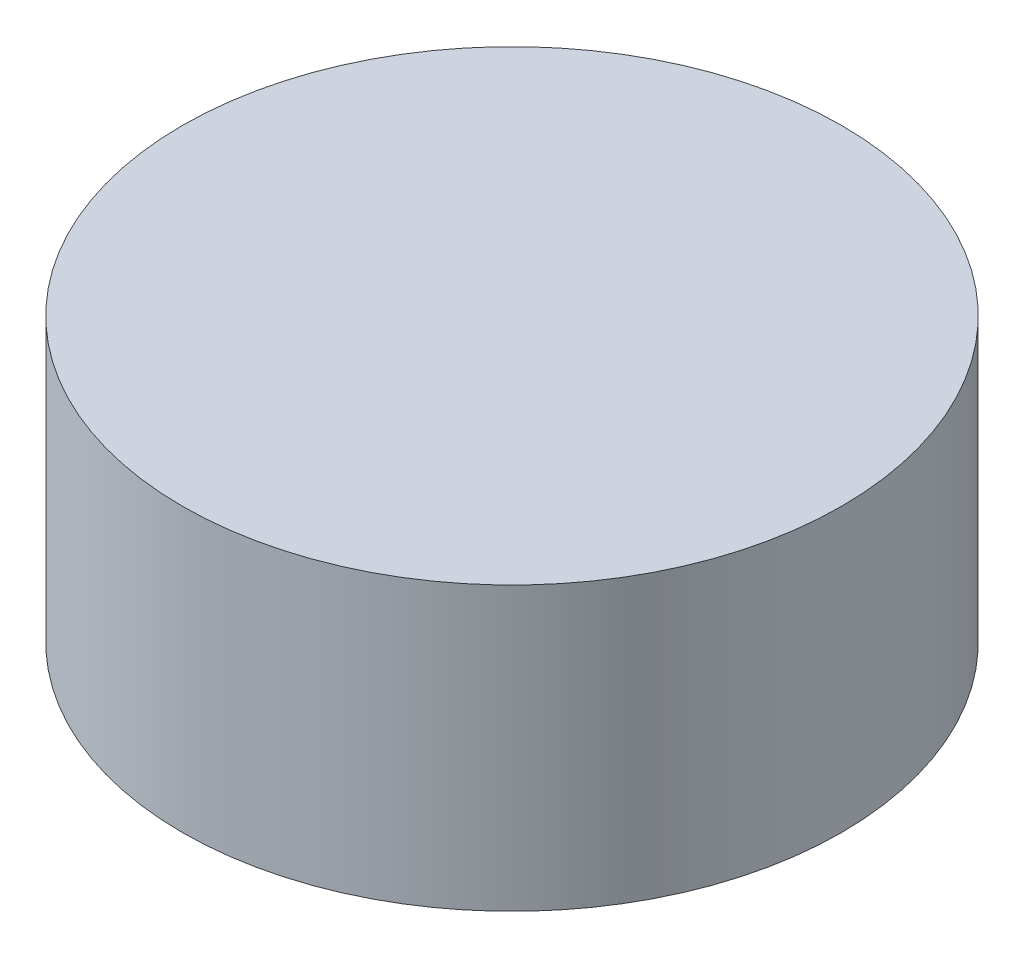
from build123d import *

# Parameters (mm, degrees)
SKETCH1_R           = 35
BOSS_EXTRUDE1_DEPTH = 30


with BuildPart() as part:
    # Sketch1 → Boss-Extrude1 (new body)
    with BuildSketch(Plane(origin=(0, 0, 0), x_dir=(1, 0, 0), z_dir=(0, 1, 0))):
        with Locations(Location((0, 0, 0), (0, 0, 270))):
            Circle(SKETCH1_R)
    extrude(amount=-BOSS_EXTRUDE1_DEPTH)


solid = part.part
